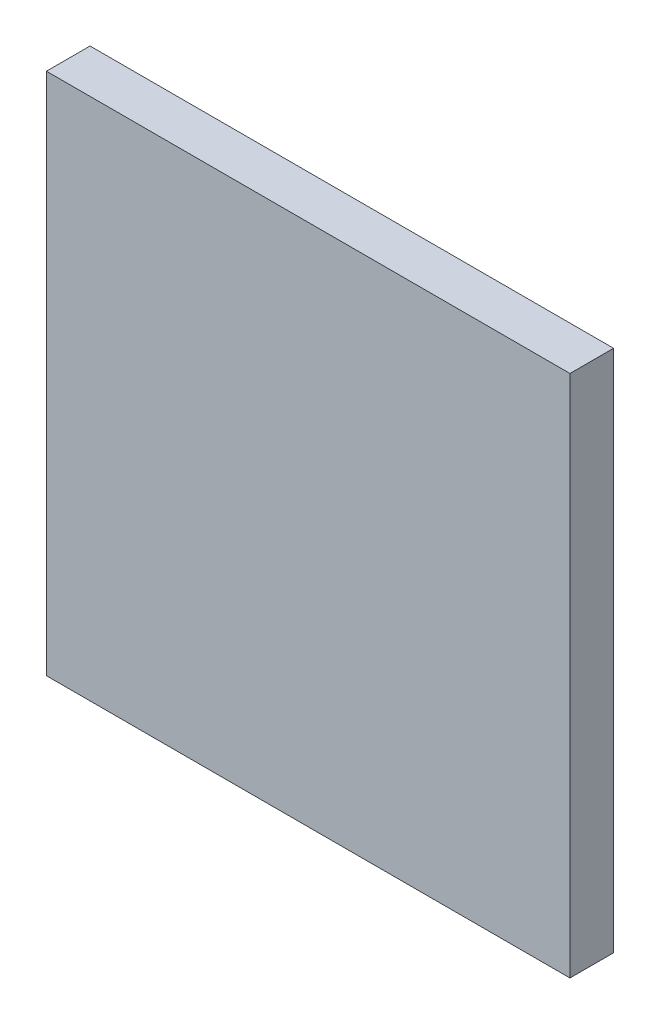
from build123d import *

# Parameters (mm, degrees)
SKETCH1_W           = 60
SKETCH1_H           = 60
BOSS_EXTRUDE1_DEPTH = 5


with BuildPart() as part:
    # Sketch1 → Boss-Extrude1 (new body)
    with BuildSketch(Plane.XY):
        with Locations((-25.283018868, 4.528301887)):
            Rectangle(SKETCH1_W, SKETCH1_H)
    extrude(amount=BOSS_EXTRUDE1_DEPTH)


solid = part.part
